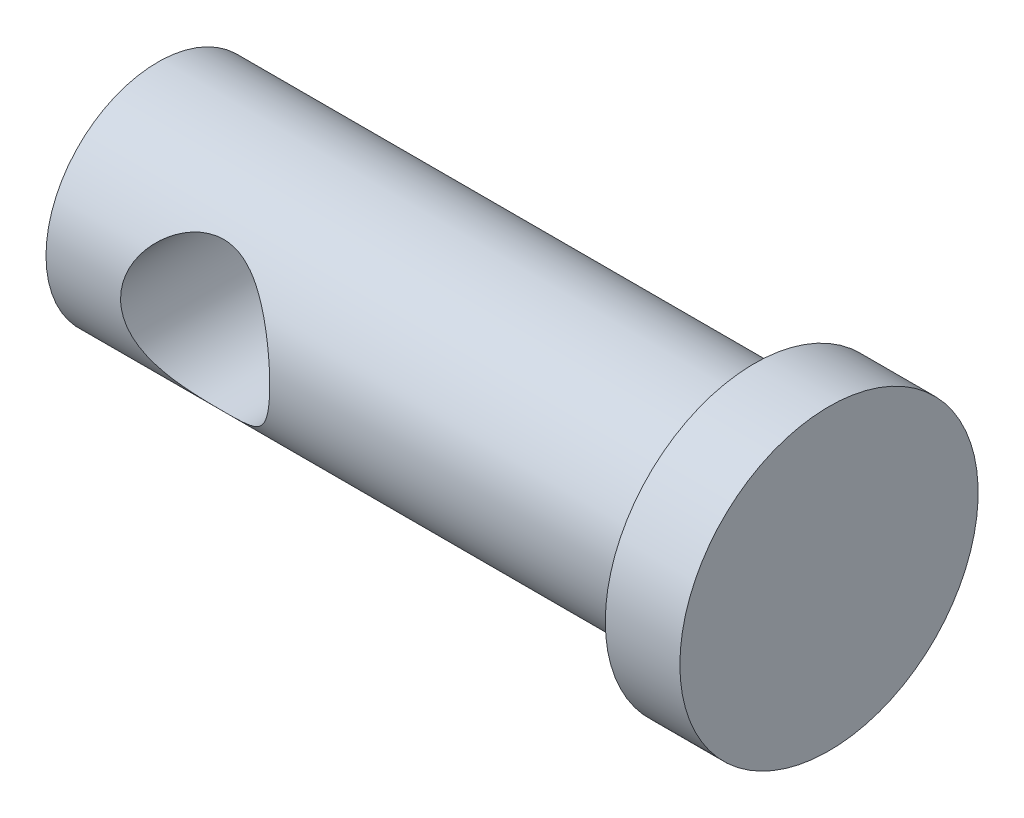
from build123d import *

# Parameters (mm, degrees)
CUT_EXTRUDE1_DEPTH      = 10.433981132
CUT_EXTRUDE1_DEPTH_BACK = 10.433981132
SKETCH2_R               = 1


with BuildPart() as part:
    # Sketch1 → Revolve1 (revolve)
    with BuildSketch(Plane.XY, mode=Mode.PRIVATE) as revolve1_sk:
        Polygon((0, 2), (-1, 2), (-1, 1.5), (-9, 1.5), (-9, 0), (0, 0), align=None)
    revolve(revolve1_sk.sketch.rotate(Axis((-9, 0, 0), (1, 0, 0)), 90), axis=Axis((-9, 0, 0), (1, 0, 0)))

    # Sketch2 → Cut-Extrude1 (cut, two sides: drawn at the far end of the back side and taken through both)
    with BuildSketch(Plane.XY.offset(-CUT_EXTRUDE1_DEPTH_BACK)):
        with Locations((-7, 0)):
            Circle(SKETCH2_R)
    extrude(amount=CUT_EXTRUDE1_DEPTH + CUT_EXTRUDE1_DEPTH_BACK, mode=Mode.SUBTRACT)


solid = part.part
